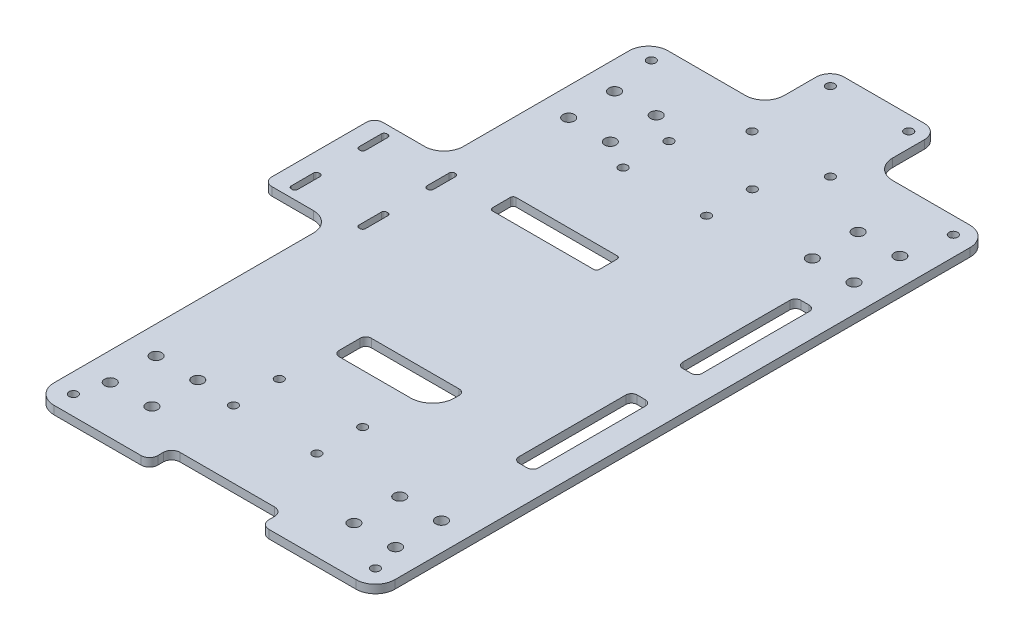
from build123d import *

# Parameters (mm, degrees)
SKETCH1_W           = 122.7
SKETCH1_H           = 200
BOSS_EXTRUDE1_DEPTH = 3
CUT_EXTRUDE1_DEPTH  = 3
SKETCH4_R           = 1.55
SKETCH4_W           = 25
SKETCH4_H           = 40
BOSS_EXTRUDE2_DEPTH = 3
SKETCH3_R           = 2.05
CUT_EXTRUDE2_DEPTH  = 162.547431115
CUT_EXTRUDE3_DEPTH  = 162.547431115
FILLET1_R           = 5
SKETCH8_R           = 1.55
CUT_EXTRUDE4_DEPTH  = 162.547431115
BOSS_EXTRUDE3_DEPTH = 3
SKETCH10_R          = 1.55
CUT_EXTRUDE5_DEPTH  = 162.547431115
SKETCH11_W          = 41.35
SKETCH11_H          = 8
BOSS_EXTRUDE4_DEPTH = 3
SKETCH12_R          = 1.55
CUT_EXTRUDE6_DEPTH  = 162.547431115
CUT_EXTRUDE7_DEPTH  = 162.547431115
FILLET2_R           = 7
FILLET3_R           = 3


with BuildPart() as part:
    # Sketch1 → Boss-Extrude1 (new body)
    with BuildSketch(Plane(origin=(0, 0, 0), x_dir=(1, 0, 0), z_dir=(0, 1, 0))):
        Rectangle(SKETCH1_W, SKETCH1_H)
    extrude(amount=BOSS_EXTRUDE1_DEPTH)

    # Sketch2 → Cut-Extrude1 (cut)
    with BuildSketch(Plane(origin=(0, 3, 0), x_dir=(1, 0, 0), z_dir=(0, 1, 0))):
        with BuildLine():
            Line((-18.152055024, -29.995579425), (13.5, -29.995579425))
            ThreePointArc((13.5, -29.995579425), (14.914213562, -30.581365862), (15.5, -31.995579425))
            Line((15.5, -31.995579425), (15.5, -33.553711953))
            ThreePointArc((15.5, -33.553711953), (13.156854249, -39.210566203), (7.5, -41.553711953))
            Line((7.5, -41.553711953), (-18.152055024, -41.553711953))
            ThreePointArc((-18.152055024, -41.553711953), (-19.566268586, -40.967925516), (-20.152055024, -39.553711953))
            Line((-20.152055024, -39.553711953), (-20.152055024, -31.995579425))
            ThreePointArc((-20.152055024, -31.995579425), (-19.566268586, -30.581365862), (-18.152055024, -29.995579425))
        make_face()
        with BuildLine():
            Line((-36.013447652, 39.9423949), (0.45645456, 39.9423949))
            ThreePointArc((0.45645456, 39.9423949), (1.163561342, 39.649501681), (1.45645456, 38.9423949))
            Line((1.45645456, 38.9423949), (1.45645456, 32.48216489))
            ThreePointArc((1.45645456, 32.48216489), (1.163561342, 31.775058109), (0.45645456, 31.48216489))
            Line((0.45645456, 31.48216489), (-36.013447652, 31.48216489))
            ThreePointArc((-36.013447652, 31.48216489), (-36.720554433, 31.775058109), (-37.013447652, 32.48216489))
            Line((-37.013447652, 32.48216489), (-37.013447652, 38.9423949))
            ThreePointArc((-37.013447652, 38.9423949), (-36.720554433, 39.649501681), (-36.013447652, 39.9423949))
        make_face()
    extrude(amount=-CUT_EXTRUDE1_DEPTH, mode=Mode.SUBTRACT)

    # Sketch4 → Boss-Extrude2 (add)
    # profile 1 of 2: a face of its own
    with BuildSketch(Plane(origin=(0, 3, 0), x_dir=(1, 0, 0), z_dir=(0, 1, 0))):
        with BuildLine():
            Line((-19.5, 100), (19.5, 100))
            Line((19.5, 100), (34.5, 100))
            ThreePointArc((34.5, 100), (23.893398282, 104.393398282), (19.5, 115))
            Line((19.5, 115), (19.5, 136.5))
            Line((19.5, 136.5), (-19.5, 136.5))
            Line((-19.5, 136.5), (-19.5, 115))
            ThreePointArc((-19.5, 115), (-23.893398282, 104.393398282), (-34.5, 100))
            Line((-34.5, 100), (-19.5, 100))
        make_face()
        with Locations(Location((14.1, 103, 0), (0, 0, 270))):
            Circle(SKETCH4_R, mode=Mode.SUBTRACT)
        with Locations(Location((-14.1, 103, 0), (0, 0, 270))):
            Circle(SKETCH4_R, mode=Mode.SUBTRACT)
        with Locations(Location((14.1, 131.2, 0), (0, 0, 270))):
            Circle(SKETCH4_R, mode=Mode.SUBTRACT)
        with Locations(Location((-14.1, 131.2, 0), (0, 0, 270))):
            Circle(SKETCH4_R, mode=Mode.SUBTRACT)
    # profile 2 of 2: a face of its own
    with BuildSketch(Plane(origin=(0, 3, 0), x_dir=(1, 0, 0), z_dir=(0, 1, 0))):
        with Locations((-73.85, 19.375730275)):
            Rectangle(SKETCH4_W, SKETCH4_H)
    extrude(amount=-BOSS_EXTRUDE2_DEPTH)

    # Sketch3 → Cut-Extrude2 (cut, through all)
    with BuildSketch(Plane(origin=(0, 3, 0), x_dir=(1, 0, 0), z_dir=(0, 1, 0))):
        with Locations(Location((51.35, 90.75, 0), (0, 0, 270))):
            Circle(SKETCH3_R)
        with Locations(Location((36.35, 90.75, 0), (0, 0, 270))):
            Circle(SKETCH3_R)
        with Locations(Location((36.35, 74.25, 0), (0, 0, 270))):
            Circle(SKETCH3_R)
        with Locations(Location((51.35, 74.25, 0), (0, 0, 270))):
            Circle(SKETCH3_R)
        with Locations(Location((-51.35, 74.25, 0), (0, 0, 90))):
            Circle(SKETCH3_R)
        with Locations(Location((-36.35, 74.25, 0), (0, 0, 90))):
            Circle(SKETCH3_R)
        with Locations(Location((-36.35, 90.75, 0), (0, 0, 90))):
            Circle(SKETCH3_R)
        with Locations(Location((-51.35, 90.75, 0), (0, 0, 90))):
            Circle(SKETCH3_R)
        with Locations(Location((-51.35, -90.75, 0), (0, 0, 270))):
            Circle(SKETCH3_R)
        with Locations(Location((-36.35, -90.75, 0), (0, 0, 270))):
            Circle(SKETCH3_R)
        with Locations(Location((-36.35, -74.25, 0), (0, 0, 270))):
            Circle(SKETCH3_R)
        with Locations(Location((-51.35, -74.25, 0), (0, 0, 270))):
            Circle(SKETCH3_R)
        with Locations(Location((51.35, -74.25, 0), (0, 0, 90))):
            Circle(SKETCH3_R)
        with Locations(Location((36.35, -74.25, 0), (0, 0, 90))):
            Circle(SKETCH3_R)
        with Locations(Location((36.35, -90.75, 0), (0, 0, 90))):
            Circle(SKETCH3_R)
        with Locations(Location((51.35, -90.75, 0), (0, 0, 90))):
            Circle(SKETCH3_R)
    extrude(amount=-CUT_EXTRUDE2_DEPTH, mode=Mode.SUBTRACT)

    # Sketch5 → Cut-Extrude3 (cut, through all)
    with BuildSketch(Plane(origin=(0, 3, 0), x_dir=(1, 0, 0), z_dir=(0, 1, 0))):
        with BuildLine():
            Line((-79.044709946, 36.523418521), (-78.744709946, 36.523418521))
            ThreePointArc((-78.744709946, 36.523418521), (-78.037603165, 36.230525302), (-77.744709946, 35.523418521))
            Line((-77.744709946, 35.523418521), (-77.744709946, 27.523418521))
            ThreePointArc((-77.744709946, 27.523418521), (-78.037603165, 26.81631174), (-78.744709946, 26.523418521))
            Line((-78.744709946, 26.523418521), (-79.044709946, 26.523418521))
            ThreePointArc((-79.044709946, 26.523418521), (-79.751816728, 26.81631174), (-80.044709946, 27.523418521))
            Line((-80.044709946, 27.523418521), (-80.044709946, 35.523418521))
            ThreePointArc((-80.044709946, 35.523418521), (-79.751816728, 36.230525302), (-79.044709946, 36.523418521))
        make_face()
        with BuildLine():
            Line((-55.644709946, 35.523418521), (-55.644709946, 27.523418521))
            ThreePointArc((-55.644709946, 27.523418521), (-55.351816728, 26.81631174), (-54.644709946, 26.523418521))
            Line((-54.644709946, 26.523418521), (-54.344709946, 26.523418521))
            ThreePointArc((-54.344709946, 26.523418521), (-53.637603165, 26.81631174), (-53.344709946, 27.523418521))
            Line((-53.344709946, 27.523418521), (-53.344709946, 35.523418521))
            ThreePointArc((-53.344709946, 35.523418521), (-53.637603165, 36.230525302), (-54.344709946, 36.523418521))
            Line((-54.344709946, 36.523418521), (-54.644709946, 36.523418521))
            ThreePointArc((-54.644709946, 36.523418521), (-55.351816728, 36.230525302), (-55.644709946, 35.523418521))
        make_face()
        with BuildLine():
            Line((-54.344709946, 2.123418521), (-54.644709946, 2.123418521))
            ThreePointArc((-54.644709946, 2.123418521), (-55.351816728, 2.41631174), (-55.644709946, 3.123418521))
            Line((-55.644709946, 3.123418521), (-55.644709946, 11.123418521))
            ThreePointArc((-55.644709946, 11.123418521), (-55.351816728, 11.830525302), (-54.644709946, 12.123418521))
            Line((-54.644709946, 12.123418521), (-54.344709946, 12.123418521))
            ThreePointArc((-54.344709946, 12.123418521), (-53.637603165, 11.830525302), (-53.344709946, 11.123418521))
            Line((-53.344709946, 11.123418521), (-53.344709946, 3.123418521))
            ThreePointArc((-53.344709946, 3.123418521), (-53.637603165, 2.41631174), (-54.344709946, 2.123418521))
        make_face()
        with BuildLine():
            Line((-77.744709946, 3.123418521), (-77.744709946, 11.123418521))
            ThreePointArc((-77.744709946, 11.123418521), (-78.037603165, 11.830525302), (-78.744709946, 12.123418521))
            Line((-78.744709946, 12.123418521), (-79.044709946, 12.123418521))
            ThreePointArc((-79.044709946, 12.123418521), (-79.751816728, 11.830525302), (-80.044709946, 11.123418521))
            Line((-80.044709946, 11.123418521), (-80.044709946, 3.123418521))
            ThreePointArc((-80.044709946, 3.123418521), (-79.751816728, 2.41631174), (-79.044709946, 2.123418521))
            Line((-79.044709946, 2.123418521), (-78.744709946, 2.123418521))
            ThreePointArc((-78.744709946, 2.123418521), (-78.037603165, 2.41631174), (-77.744709946, 3.123418521))
        make_face()
    extrude(amount=-CUT_EXTRUDE3_DEPTH, mode=Mode.SUBTRACT)

    # Fillet1
    fillet1_edges = [part.edges().sort_by_distance(p)[0] for p in [
        (19.5, 1.5, -136.5),
        (-19.5, 1.5, -136.5),
    ]]
    fillet(fillet1_edges, radius=FILLET1_R)

    # Sketch8 → Cut-Extrude4 (cut, through all)
    with BuildSketch(Plane(origin=(0, 3, 0), x_dir=(1, 0, 0), z_dir=(0, 1, 0))):
        with Locations(Location((-26, 85, 0), (0, 0, 270))):
            Circle(SKETCH8_R)
        with Locations(Location((-26, 68.5, 0), (0, 0, 270))):
            Circle(SKETCH8_R)
        with Locations(Location((-22, -59.25, 0), (0, 0, 270))):
            Circle(SKETCH8_R)
        with Locations(Location((-22, -75.75, 0), (0, 0, 270))):
            Circle(SKETCH8_R)
        with Locations(Location((4, 85, 0), (0, 0, 270))):
            Circle(SKETCH8_R)
        with Locations(Location((4, 68.5, 0), (0, 0, 270))):
            Circle(SKETCH8_R)
        with Locations(Location((8, -59.25, 0), (0, 0, 270))):
            Circle(SKETCH8_R)
        with Locations(Location((8, -75.75, 0), (0, 0, 270))):
            Circle(SKETCH8_R)
    extrude(amount=-CUT_EXTRUDE4_DEPTH, mode=Mode.SUBTRACT)

    # Sketch9 → Boss-Extrude3 (add)
    with BuildSketch(Plane(origin=(0, 3, 0), x_dir=(1, 0, 0), z_dir=(0, 1, 0))):
        with BuildLine():
            Line((61.35, 100), (34.5, 100))
            ThreePointArc((34.5, 100), (24.625791171, 103.708410209), (19.633931253, 113))
            Line((19.633931253, 113), (61.35, 113))
            Line((61.35, 113), (61.35, 100))
        make_face()
        with BuildLine():
            Line((-61.35, 100), (-61.35, 113))
            Line((-61.35, 113), (-19.633931253, 113))
            ThreePointArc((-19.633931253, 113), (-24.625791171, 103.708410209), (-34.5, 100))
            Line((-34.5, 100), (-61.35, 100))
        make_face()
    extrude(amount=-BOSS_EXTRUDE3_DEPTH)

    # Sketch10 → Cut-Extrude5 (cut, through all)
    with BuildSketch(Plane(origin=(0, 3, 0), x_dir=(1, 0, 0), z_dir=(0, 1, 0))):
        with Locations(Location((54.35, 107, 0), (0, 0, 270))):
            Circle(SKETCH10_R)
        with Locations(Location((-54.35, 107, 0), (0, 0, 90))):
            Circle(SKETCH10_R)
    extrude(amount=-CUT_EXTRUDE5_DEPTH, mode=Mode.SUBTRACT)

    # Sketch11 → Boss-Extrude4 (add)
    with BuildSketch(Plane(origin=(0, 3, 0), x_dir=(1, 0, 0), z_dir=(0, 1, 0))):
        with Locations((-40.675, -104)):
            Rectangle(SKETCH11_W, SKETCH11_H)
        with Locations((40.675, -104)):
            Rectangle(SKETCH11_W, SKETCH11_H)
    extrude(amount=-BOSS_EXTRUDE4_DEPTH)

    # Sketch12 → Cut-Extrude6 (cut, through all)
    with BuildSketch(Plane(origin=(0, 3, 0), x_dir=(1, 0, 0), z_dir=(0, 1, 0))):
        with Locations(Location((54.35, -101, 0), (0, 0, 270))):
            Circle(SKETCH12_R)
        with Locations(Location((-54.35, -101, 0), (0, 0, 90))):
            Circle(SKETCH12_R)
    extrude(amount=-CUT_EXTRUDE6_DEPTH, mode=Mode.SUBTRACT)

    # Sketch13 → Cut-Extrude7 (cut, through all)
    with BuildSketch(Plane(origin=(0, 3, 0), x_dir=(1, 0, 0), z_dir=(0, 1, 0))):
        with BuildLine():
            Line((47.35, 0.161425156), (50.35, 0.161425156))
            ThreePointArc((50.35, 0.161425156), (51.764213562, -0.424361281), (52.35, -1.838574844))
            Line((52.35, -1.838574844), (52.35, -40.364069296))
            ThreePointArc((52.35, -40.364069296), (51.764213562, -41.778282859), (50.35, -42.364069296))
            Line((50.35, -42.364069296), (47.35, -42.364069296))
            ThreePointArc((47.35, -42.364069296), (45.935786438, -41.778282859), (45.35, -40.364069296))
            Line((45.35, -40.364069296), (45.35, -1.838574844))
            ThreePointArc((45.35, -1.838574844), (45.935786438, -0.424361281), (47.35, 0.161425156))
        make_face()
        with BuildLine():
            Line((45.35, 57.139055763), (45.35, 18.613561311))
            ThreePointArc((45.35, 18.613561311), (45.935786438, 17.199347748), (47.35, 16.613561311))
            Line((47.35, 16.613561311), (50.35, 16.613561311))
            ThreePointArc((50.35, 16.613561311), (51.764213562, 17.199347748), (52.35, 18.613561311))
            Line((52.35, 18.613561311), (52.35, 57.139055763))
            ThreePointArc((52.35, 57.139055763), (51.764213562, 58.553269326), (50.35, 59.139055763))
            Line((50.35, 59.139055763), (47.35, 59.139055763))
            ThreePointArc((47.35, 59.139055763), (45.935786438, 58.553269326), (45.35, 57.139055763))
        make_face()
    extrude(amount=-CUT_EXTRUDE7_DEPTH, mode=Mode.SUBTRACT)

    # Fillet2
    fillet2_edges = [part.edges().sort_by_distance(p)[0] for p in [
        (61.35, 1.5, 108),
        (-61.35, 1.5, 0.624269725),
        (-61.35, 1.5, -39.375730275),
        (-61.35, 1.5, 108),
        (61.35, 1.5, -113),
        (-61.35, 1.5, -113),
        (19.633931253, 1.5, -113),
        (-19.633931253, 1.5, -113),
    ]]
    fillet(fillet2_edges, radius=FILLET2_R)

    # Fillet3
    fillet3_edges = [part.edges().sort_by_distance(p)[0] for p in [
        (-20, 1.5, 100),
        (-20, 1.5, 108),
        (20, 1.5, 108),
        (20, 1.5, 100),
        (-86.35, 1.5, 0.624269725),
        (-86.35, 1.5, -39.375730275),
    ]]
    fillet(fillet3_edges, radius=FILLET3_R)


solid = part.part
